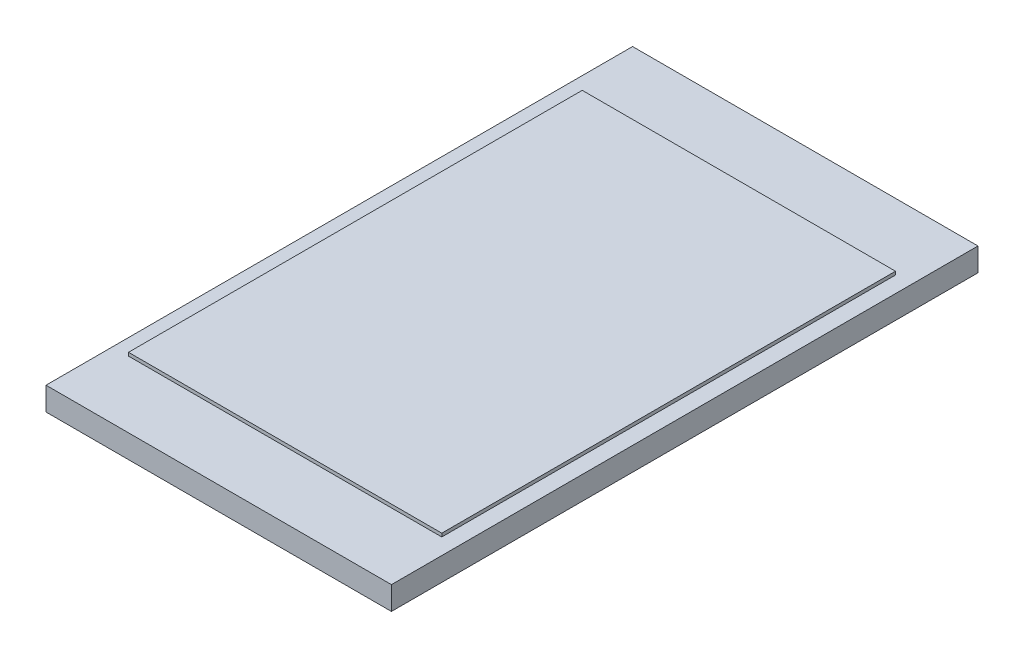
from build123d import *

# Parameters (mm, degrees)
SKETCH1_W           = 132.08
SKETCH1_H           = 224.282
BOSS_EXTRUDE1_DEPTH = 8.89
SKETCH2_W           = 119.787595668
SKETCH2_H           = 173.482
BOSS_EXTRUDE2_DEPTH = 1.27


with BuildPart() as part:
    # Sketch1 → Boss-Extrude1 (new body)
    with BuildSketch(Plane(origin=(0, 0, 0), x_dir=(1, 0, 0), z_dir=(0, 1, 0))):
        with Locations((-66.04, 112.141)):
            Rectangle(SKETCH1_W, SKETCH1_H)
    extrude(amount=BOSS_EXTRUDE1_DEPTH)

    # Sketch2 → Boss-Extrude2 (add)
    with BuildSketch(Plane(origin=(0, 8.89, 0), x_dir=(1, 0, 0), z_dir=(0, 1, 0))):
        with Locations((-66.04, 112.141)):
            Rectangle(SKETCH2_W, SKETCH2_H)
    extrude(amount=BOSS_EXTRUDE2_DEPTH)


solid = part.part
